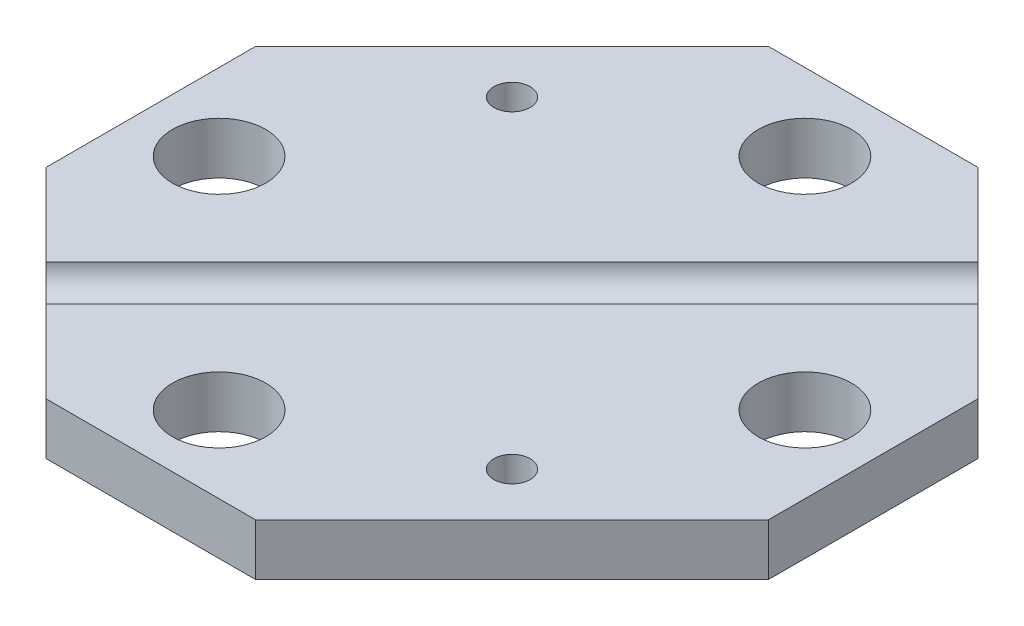
from build123d import *

# Parameters (mm, degrees)
SKETCH1_R           = 4.5
BOSS_EXTRUDE1_DEPTH = 5
CUT_EXTRUDE1_REACH  = 80.329
CUT_EXTRUDE3_REACH  = 59.217
SKETCH6_R           = 1.75


with BuildPart() as part:
    # Sketch1 → Boss-Extrude1 (new body)
    with BuildSketch(Plane(origin=(0, 0, 0), x_dir=(1, 0, 0), z_dir=(0, 1, 0))):
        Polygon((-40.303943114, 15.555205773), (-15.555205773, 40.303943114), (4.694794227, 40.303943114), (24.042773974, 20.955963368), (24.042773974, 0.705963368), (-0.705963368, -24.042773974), (-20.955963368, -24.042773974), (-40.303943114, -4.694794227), align=None)
        with Locations(Location((-11.666118476, -16.618152771, 0), (0, 0, 270))):
            Circle(SKETCH1_R, mode=Mode.SUBTRACT)
        with Locations(Location((16.618152771, 11.666118476, 0), (0, 0, 270))):
            Circle(SKETCH1_R, mode=Mode.SUBTRACT)
        with Locations(Location((-4.595050664, 32.879321912, 0), (0, 0, 270))):
            Circle(SKETCH1_R, mode=Mode.SUBTRACT)
        with Locations(Location((-32.879321912, 4.595050664, 0), (0, 0, 270))):
            Circle(SKETCH1_R, mode=Mode.SUBTRACT)
    extrude(amount=BOSS_EXTRUDE1_DEPTH)

    # Sketch4 → Cut-Extrude1 (cut, up to next)
    with BuildSketch(Plane(origin=(22.499368671, 0, -22.499368671), x_dir=(-0.7071067811865465, 0, -0.7071067811865487), z_dir=(0.7071067811865487, 0, -0.7071067811865465)), mode=Mode.PRIVATE) as cut_extrude1_sk1:
        with BuildLine():
            Line((13.998382969, 5), (8.998382969, 5))
            ThreePointArc((8.998382969, 5), (11.498382969, 2.5), (13.998382969, 5))
        make_face()
    cut_extrude1_tool1 = extrude(cut_extrude1_sk1.sketch, amount=-CUT_EXTRUDE1_REACH, mode=Mode.PRIVATE) & part.part
    add(cut_extrude1_tool1.solids().sort_by_distance((14.368784, 3.938967, -30.629953))[0], mode=Mode.SUBTRACT)

    # Sketch6 → Cut-Extrude3 (cut, up to next)
    with BuildSketch(Plane(origin=(0, 5, 0), x_dir=(1, 0, 0), z_dir=(0, 1, 0)), mode=Mode.PRIVATE) as cut_extrude3_sk1:
        with Locations(Location((-23.686933757, 23.686933757, 0), (0, 0, 270))):
            Circle(SKETCH6_R)
    cut_extrude3_tool1 = extrude(cut_extrude3_sk1.sketch, amount=-CUT_EXTRUDE3_REACH, mode=Mode.PRIVATE) & part.part
    # Sketch6 → Cut-Extrude3 (cut, up to next)
    with BuildSketch(Plane(origin=(0, 5, 0), x_dir=(1, 0, 0), z_dir=(0, 1, 0)), mode=Mode.PRIVATE) as cut_extrude3_sk2:
        with Locations(Location((7.425764616, -7.425764616, 0), (0, 0, 270))):
            Circle(SKETCH6_R)
    cut_extrude3_tool2 = extrude(cut_extrude3_sk2.sketch, amount=-CUT_EXTRUDE3_REACH, mode=Mode.PRIVATE) & part.part
    add(cut_extrude3_tool1.solids().sort_by_distance((-23.686934, 5, -23.686934))[0], mode=Mode.SUBTRACT)
    add(cut_extrude3_tool2.solids().sort_by_distance((7.425765, 5, 7.425765))[0], mode=Mode.SUBTRACT)


solid = part.part
